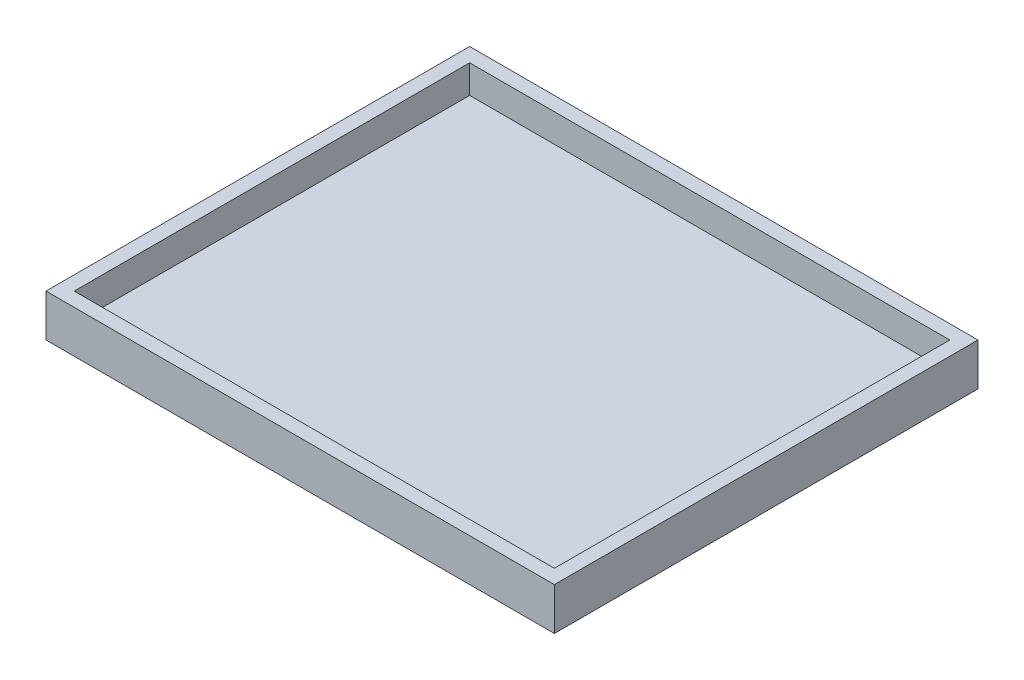
from build123d import *

# Parameters (mm, degrees)
SKETCH1_W           = 91.44
SKETCH1_H           = 76.2
BOSS_EXTRUDE1_DEPTH = 7.62
SKETCH2_W           = 86.36
SKETCH2_H           = 71.12
CUT_EXTRUDE3_DEPTH  = 5.08


with BuildPart() as part:
    # Sketch1 → Boss-Extrude1 (new body)
    with BuildSketch(Plane(origin=(0, 0, 0), x_dir=(1, 0, 0), z_dir=(0, 1, 0))):
        with Locations((0.638410311, -31.003823845)):
            Rectangle(SKETCH1_W, SKETCH1_H)
    extrude(amount=BOSS_EXTRUDE1_DEPTH)

    # Sketch2 → Cut-Extrude3 (cut)
    with BuildSketch(Plane(origin=(0, 7.62, 0), x_dir=(1, 0, 0), z_dir=(0, 1, 0))):
        with Locations((0.638410311, -31.003823845)):
            Rectangle(SKETCH2_W, SKETCH2_H)
    extrude(amount=-CUT_EXTRUDE3_DEPTH, mode=Mode.SUBTRACT)


solid = part.part
